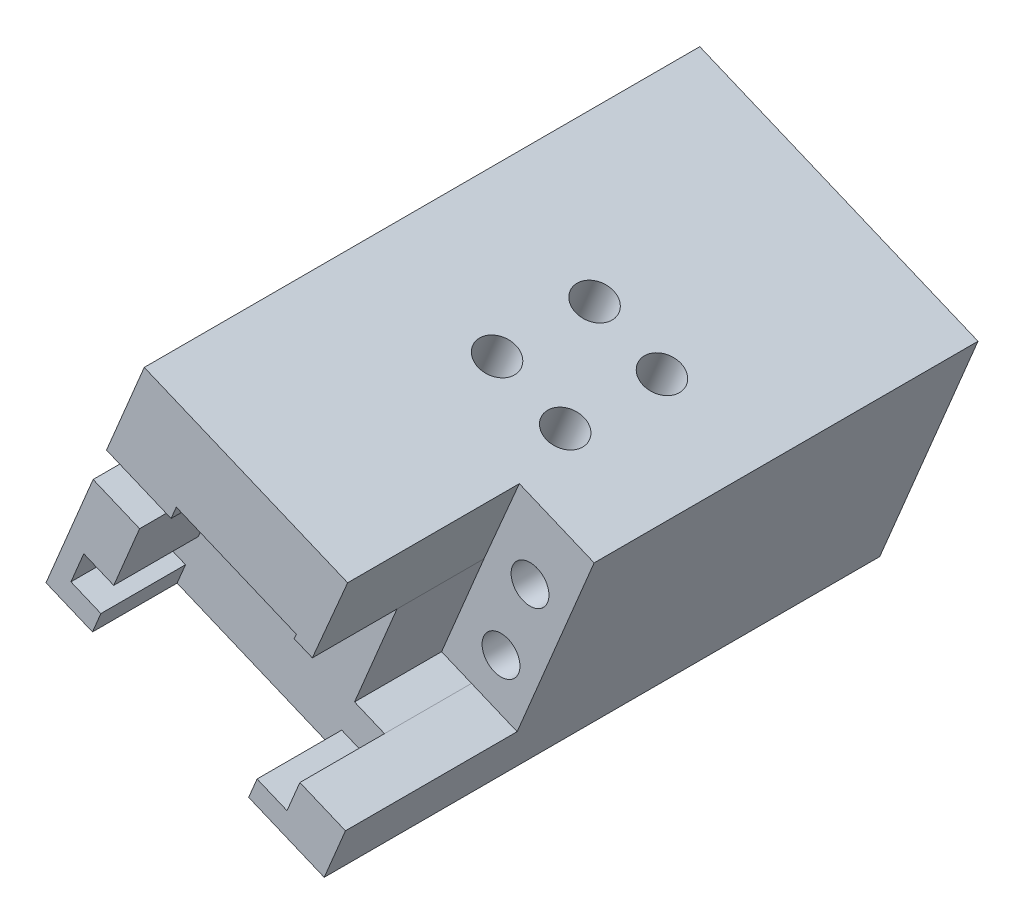
from build123d import *

# Parameters (mm, degrees)
BOSS_EXTRUDE1_DEPTH  = 15.696834748
SKETCH6_W            = 13.410834748
SKETCH6_H            = 5.149998248
CUT_EXTRUDE1_DEPTH   = 22.86
BOSS_EXTRUDE7_DEPTH  = 3.175
SKETCH12_R           = 2.8
CUT_EXTRUDE3_DEPTH   = 9.1
SKETCH13_R           = 2.8
CUT_EXTRUDE4_DEPTH   = 9.1
CUT_EXTRUDE6_DEPTH   = 98.762
SKETCH15_R           = 3.175
BOSS_EXTRUDE8_DEPTH  = 19.05
BOSS_EXTRUDE9_DEPTH  = 25.4
BOSS_EXTRUDE10_DEPTH = 25.4
BOSS_EXTRUDE11_DEPTH = 25.4
SKETCH21_W           = 11.024255738
SKETCH21_H           = 18.102082359
BOSS_EXTRUDE12_DEPTH = 6.604


with BuildPart() as part:
    # Sketch1 → Boss-Extrude1 (new body)
    with BuildSketch(Plane.XY):
        Polygon((-68.527338122, 69.932197609), (-69.296818428, 68.086800577), (-71.973324576, 69.203128997), (-77.782900884, 55.270381406), (-82.212980026, 57.11809741), (-84.113890894, 52.559260429), (-79.683811753, 50.711544425), (-80.926887502, 47.730352729), (-87.80424407, 50.598023124), (-73.267575276, 85.460416929), (-27.617891017, 66.425741791), (-42.154559811, 31.563347985), (-57.815709039, 38.093620707), (-56.573548036, 41.072618624), (-52.143468895, 39.22490262), (-50.242558026, 43.783739601), (-54.672637167, 45.631455606), (-48.401372675, 60.671441415), (-51.077878823, 61.787769834), (-50.770086701, 62.525928647), align=None)
    boss_extrude1 = extrude(amount=BOSS_EXTRUDE1_DEPTH)

    # Mirror4: Boss-Extrude1 across plane
    add(boss_extrude1.mirror(Plane(origin=(0, 0, 0), x_dir=(1, 0, 0), z_dir=(0, 0, -1))))

    # Sketch6 → Cut-Extrude1 (cut)
    with BuildSketch(Plane(origin=(-85.89491474, 35.815840233, 0), x_dir=(0, 0, -1), z_dir=(0.9229765876476943, -0.38485610123034036, 0))):
        with Locations((-8.991417374, 33.598495643)):
            Rectangle(SKETCH6_W, SKETCH6_H)
    cut_extrude1 = extrude(amount=-CUT_EXTRUDE1_DEPTH, mode=Mode.SUBTRACT)

    # Mirror5: Cut-Extrude1 across plane
    add(cut_extrude1.mirror(Plane.XY), mode=Mode.SUBTRACT)

    # Sketch8 → Boss-Extrude7 (add, symmetric)
    with BuildSketch(Plane.XY):
        Polygon((-73.267575276, 85.460416929), (-87.80424407, 50.598023124), (-42.154559811, 31.563347985), (-27.617891017, 66.425741791), align=None)
    extrude(amount=BOSS_EXTRUDE7_DEPTH, both=True)

    # Sketch12 → Cut-Extrude3 (cut)
    with BuildSketch(Plane(origin=(19.504696032, 46.776906301, 0), x_dir=(0.9229765876476947, -0.38485610123033953, 0), z_dir=(0.38485610123033953, 0.9229765876476949, 0))):
        with Locations(Location((-81.485896456, 7.968513911, 0), (0, 0, 180))):
            Circle(SKETCH12_R)
        with Locations(Location((-70.563570403, 7.856727715, 0), (0, 0, 180))):
            Circle(SKETCH12_R)
        with Locations(Location((-70.708700217, -6.323512761, 0), (0, 0, 180))):
            Circle(SKETCH12_R)
        with Locations(Location((-81.632170363, -6.323512761, 0), (0, 0, 180))):
            Circle(SKETCH12_R)
    extrude(amount=-CUT_EXTRUDE3_DEPTH, mode=Mode.SUBTRACT)

    # Sketch13 → Cut-Extrude4 (cut)
    with BuildSketch(Plane.XY.offset(15.696834748)):
        with Locations((-45.884678207, 49.584175244)):
            Circle(SKETCH13_R)
        with Locations((-41.590000601, 60.809890325)):
            Circle(SKETCH13_R)
    extrude(amount=-CUT_EXTRUDE4_DEPTH, mode=Mode.SUBTRACT)

    # Sketch14 → Cut-Extrude6 (cut)
    with BuildSketch(Plane.XY.offset(15.696834748)):
        Polygon((-46.640769275, 33.433975157), (-32.104100481, 68.296368962), (-25.409987335, 65.505106084), (-39.946656129, 30.642712279), align=None)
    extrude(amount=-CUT_EXTRUDE6_DEPTH, mode=Mode.SUBTRACT)

    # Sketch15 → Boss-Extrude8 (add)
    with BuildSketch(Plane(origin=(4.968027238, 11.914512496, 0), x_dir=(0.9229765876476949, -0.3848561012303393, 0), z_dir=(-0.3848561012303393, -0.9229765876476949, 0))):
        with Locations(Location((-95.882584307, 0, 0), (0, 0, 180))):
            Circle(SKETCH15_R)
    extrude(amount=BOSS_EXTRUDE8_DEPTH)

    # Sketch17 → Boss-Extrude9 (add)
    with BuildSketch(Plane.XY.offset(15.696834748)):
        Polygon((-51.077878823, 61.787769834), (-48.401372675, 60.671441415), (-43.173444366, 72.911983906), (-73.267575276, 85.460416929), (-78.850681144, 72.070799392), (-71.973324576, 69.203128997), (-69.296818428, 68.086800577), (-68.527338122, 69.932197609), (-50.770086701, 62.525928647), align=None)
        Polygon((-84.113890894, 52.559260429), (-82.212980026, 57.11809741), (-77.782900884, 55.270381406), (-73.955332823, 64.449801187), (-80.832689391, 67.317471582), (-87.80424407, 50.598023124), (-80.926887502, 47.730352729), (-79.683811753, 50.711544425), align=None)
        Polygon((-43.497872754, 40.971389524), (-50.242558026, 43.783739601), (-52.143468895, 39.22490262), (-56.573548036, 41.072618624), (-57.815709039, 38.093620707), (-46.640769275, 33.433975157), align=None)
    boss_extrude9 = extrude(amount=BOSS_EXTRUDE9_DEPTH)

    # Sketch18 → Boss-Extrude10 (add)
    with BuildSketch(Plane.XY.offset(3.175)):
        Polygon((-79.683811753, 50.711544425), (-80.926887502, 47.730352729), (-57.815709039, 38.093620707), (-56.573548036, 41.072618624), (-52.143468895, 39.22490262), (-50.242558026, 43.783739601), (-54.672637167, 45.631455606), (-48.401372675, 60.671441415), (-51.077878823, 61.787769834), (-50.770086701, 62.525928647), (-68.527338122, 69.932197609), (-69.296818428, 68.086800577), (-71.973324576, 69.203128997), (-78.850681144, 72.070799392), (-80.832689391, 67.317471582), (-73.955332823, 64.449801187), (-77.782900884, 55.270381406), (-82.212980026, 57.11809741), (-84.113890894, 52.559260429), align=None)
    boss_extrude10 = extrude(amount=BOSS_EXTRUDE10_DEPTH)

    # Mirror6: Boss-Extrude9, Boss-Extrude10 across plane
    add(boss_extrude9.mirror(Plane.XY))
    add(boss_extrude10.mirror(Plane.XY))

    # Sketch19 → Boss-Extrude11 (add)
    with BuildSketch(Plane(origin=(0, 0, -15.696834748), x_dir=(-1, 0, 0), z_dir=(0, 0, -1))):
        Polygon((43.497872754, 40.971389524), (50.242558026, 43.783739601), (54.672637167, 45.631455606), (48.401372675, 60.671441415), (43.173444366, 72.911983906), (32.104100481, 68.296368962), align=None)
    extrude(amount=BOSS_EXTRUDE11_DEPTH)

    # Sketch21 → Boss-Extrude12 (add)
    with BuildSketch(Plane(origin=(4.968027238, 11.914512496, 0), x_dir=(0.9229765876476949, -0.3848561012303393, 0), z_dir=(-0.3848561012303393, -0.9229765876476949, 0))):
        with Locations((-95.002091614, -1.001456214)):
            Rectangle(SKETCH21_W, SKETCH21_H)
    extrude(amount=BOSS_EXTRUDE12_DEPTH)


solid = part.part
